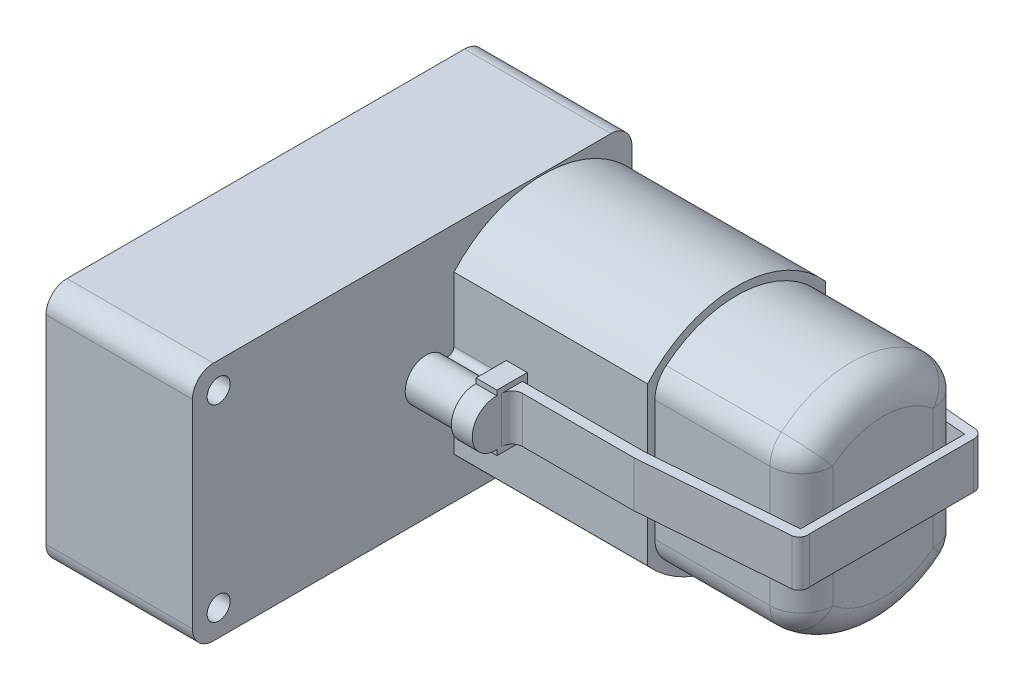
from build123d import *
from build123d.topology import SkipClean

# Parameters (mm, degrees)
SKETCH1_W                = 14
SKETCH1_H                = 42
MAIN_BODY_DEPTH          = 23
FILLET1_R                = 2
MOTOR_HOLDER_DEPTH       = 18.5
BOSS_EXTRUDE3_DEPTH      = 5
SKETCH4_R                = 1.1
NUT_HOLES_DEPTH          = 15
SKETCH5_W                = 2
SKETCH5_H                = 4
BOSS_EXTRUDE4_DEPTH      = 5
BOSS_EXTRUDE5_DEPTH      = 4
CUT_EXTRUDE2_START       = -2
CUT_EXTRUDE2_DEPTH       = 2
BOSS_EXTRUDE6_DEPTH      = 14
BOSS_EXTRUDE7_DEPTH      = 2
FILLET2_R                = 3
BOSS_EXTRUDE8_DEPTH      = 2.2
BOSS_EXTRUDE8_DEPTH_BACK = 2.2
FILLET3_R                = 1
SKETCH12_R               = 3.5
SKETCH12_R_2             = 3.070336519
BOSS_EXTRUDE9_DEPTH      = 1
SKETCH14_R               = 3
BOSS_EXTRUDE10_DEPTH     = 1
SKETCH15_R               = 1
SHAFT_DEPTH              = 7
SKETCH16_R               = 2
BOSS_EXTRUDE12_DEPTH     = 1.5


with BuildPart() as part:
    # Sketch1 → Main Body (new body)
    with BuildSketch(Plane(origin=(0, 0, 0), x_dir=(1, 0, 0), z_dir=(0, 1, 0))):
        with Locations((-14.72963025, -0.456790856)):
            Rectangle(SKETCH1_W, SKETCH1_H)
    extrude(amount=MAIN_BODY_DEPTH)

    # Fillet1
    fillet1_edges = [part.edges().sort_by_distance(p)[0] for p in [
        (-14.72963025, 23, -20.543209144),
        (-14.72963025, 0, -20.543209144),
        (-14.72963025, 0, 21.456790856),
        (-14.72963025, 23, 21.456790856),
    ]]
    fillet(fillet1_edges, radius=FILLET1_R)

    # Sketch2 → Motor Holder (add)
    with BuildSketch(Plane(origin=(-7.72963025, 0, 0), x_dir=(0, 0, -1), z_dir=(1, 0, 0))):
        with BuildLine():
            Line((3.543209144, 19.033283793), (3.543209144, 3.966716207))
            ThreePointArc((3.543209144, 3.966716207), (12.043209144, 0.142167253), (20.543209144, 3.966716207))
            Line((20.543209144, 3.966716207), (20.543209144, 19.033283793))
            ThreePointArc((20.543209144, 19.033283793), (12.043209144, 22.857832747), (3.543209144, 19.033283793))
        make_face()
    extrude(amount=MOTOR_HOLDER_DEPTH)

    # Sketch3 → Boss-Extrude3 (add)
    with BuildSketch(Plane(origin=(-7.72963025, 0, 0), x_dir=(0, 0, -1), z_dir=(1, 0, 0))):
        with BuildLine():
            Line((3.543209144, 12.866872794), (3.543209144, 10.327683852))
            ThreePointArc((3.543209144, 10.327683852), (3.130583543, 10.726570697), (2.605351044, 10.495266949))
            ThreePointArc((2.605351044, 10.495266949), (-1.12344994, 11.454900344), (2.558290761, 12.581682682))
            ThreePointArc((2.558290761, 12.581682682), (3.155784465, 12.361535772), (3.543209144, 12.866872794))
        make_face()
    extrude(amount=BOSS_EXTRUDE3_DEPTH)

    # Sketch4 → Nut Holes (cut)
    with BuildSketch(Plane(origin=(-7.72963025, 0, 0), x_dir=(0, 0, -1), z_dir=(1, 0, 0))):
        with Locations((-18.956790856, 20.5)):
            Circle(SKETCH4_R)
        with Locations((-18.956790856, 2.5)):
            Circle(SKETCH4_R)
    extrude(amount=-NUT_HOLES_DEPTH, mode=Mode.SUBTRACT)

    # Sketch5 → Boss-Extrude4 (add)
    with BuildSketch(Plane(origin=(0, 0, -20.543209144), x_dir=(-1, 0, 0), z_dir=(0, 0, -1))):
        with Locations((7.72963025, 11.5)):
            Rectangle(SKETCH5_W, SKETCH5_H)
    extrude(amount=BOSS_EXTRUDE4_DEPTH)

    # Sketch6 → Boss-Extrude5 (add)
    with BuildSketch(Plane(origin=(-6.72963025, 0, 0), x_dir=(0, 0, -1), z_dir=(1, 0, 0))):
        with BuildLine():
            ThreePointArc((21.679339079, 10.774749435), (23.912167048, 9.534327071), (25.543209144, 11.5))
            ThreePointArc((25.543209144, 11.5), (23.912167048, 13.465672929), (21.679339079, 12.225250565))
            ThreePointArc((21.679339079, 12.225250565), (21.665841795, 12.183376686), (21.649262587, 12.142624651))
            ThreePointArc((21.649262587, 12.142624651), (21.543692429, 11.456035136), (21.679339079, 10.774749435))
        make_face()
        with BuildLine():
            ThreePointArc((20.543209144, 10.774749435), (21.111274111, 11.147288257), (21.679339079, 10.774749435))
            ThreePointArc((21.679339079, 10.774749435), (21.543692429, 11.456035136), (21.649262587, 12.142624651))
            ThreePointArc((21.649262587, 12.142624651), (21.067309248, 11.796717861), (20.543209144, 12.225250565))
            Line((20.543209144, 12.225250565), (20.543209144, 10.774749435))
        make_face()
    extrude(amount=BOSS_EXTRUDE5_DEPTH)

    # Sketch7 → Cut-Extrude2 (cut)
    with BuildSketch(Plane(origin=(-6.72963025, 0, 0), x_dir=(0, 0, -1), z_dir=(1, 0, 0)).offset(CUT_EXTRUDE2_START)):
        with BuildLine():
            Line((23.543209144, 13.5), (23.543209144, 13.967200788))
            Line((23.543209144, 13.967200788), (25.760178749, 13.967200788))
            Line((25.760178749, 13.967200788), (25.760178749, 8.970470958))
            Line((25.760178749, 8.970470958), (23.543209144, 8.970470958))
            Line((23.543209144, 8.970470958), (23.543209144, 9.5))
            ThreePointArc((23.543209144, 9.5), (25.543209144, 11.5), (23.543209144, 13.5))
        make_face()
    extrude(amount=CUT_EXTRUDE2_DEPTH, mode=Mode.SUBTRACT)

    # Sketch8 → Boss-Extrude6 (add)
    with BuildSketch(Plane(origin=(10.77036975, 0, 0), x_dir=(0, 0, -1), z_dir=(1, 0, 0))):
        with BuildLine():
            Line((4.243209144, 17.35646316), (4.243209144, 5.822511997))
            ThreePointArc((4.243209144, 5.822511997), (4.526819665, 4.549237399), (5.324027945, 3.516705516))
            ThreePointArc((5.324027945, 3.516705516), (12.043209144, 1.086287771), (18.762390342, 3.516705516))
            ThreePointArc((18.762390342, 3.516705516), (19.559598622, 4.549237399), (19.843209144, 5.822511997))
            Line((19.843209144, 5.822511997), (19.843209144, 17.35646316))
            ThreePointArc((19.843209144, 17.35646316), (19.559598622, 18.629737758), (18.762390342, 19.66226964))
            ThreePointArc((18.762390342, 19.66226964), (12.043209144, 22.092687386), (5.324027945, 19.66226964))
            ThreePointArc((5.324027945, 19.66226964), (4.526819665, 18.629737758), (4.243209144, 17.35646316))
        make_face()
    extrude(amount=BOSS_EXTRUDE6_DEPTH)

    # Sketch9 → Boss-Extrude7 (add)
    with BuildSketch(Plane(origin=(-2.72963025, 0, 0), x_dir=(0, 0, -1), z_dir=(1, 0, 0))):
        with BuildLine():
            Line((20.534219475, 8.784213792), (23.432322776, 8.784213792))
            Line((23.432322776, 8.784213792), (23.432322776, 9.263820028))
            ThreePointArc((23.432322776, 9.263820028), (25.790969288, 11.48725138), (23.432322776, 13.710682731))
            Line((23.432322776, 13.710682731), (23.432322776, 14.220655847))
            Line((23.432322776, 14.220655847), (20.534219475, 14.220655847))
            Line((20.534219475, 14.220655847), (20.534219475, 8.784213792))
        make_face()
        with BuildLine():
            Line((3.543209144, 8.784213792), (0.645105842, 8.784213792))
            Line((0.645105842, 8.784213792), (0.645105842, 9.294186907))
            ThreePointArc((0.645105842, 9.294186907), (-1.71354067, 11.517618258), (0.645105842, 13.74104961))
            Line((0.645105842, 13.74104961), (0.645105842, 14.220655847))
            Line((0.645105842, 14.220655847), (3.543209144, 14.220655847))
            Line((3.543209144, 14.220655847), (3.543209144, 8.784213792))
        make_face()
    extrude(amount=BOSS_EXTRUDE7_DEPTH)

    # Fillet2
    fillet2_edges = [part.edges().sort_by_distance(p)[0] for p in [
        (24.77036975, 18.629737758, -4.526819665),
        (24.77036975, 11.589487578, -4.243209144),
        (24.77036975, 4.549237399, -4.526819665),
        (24.77036975, 1.086287771, -12.043209144),
        (24.77036975, 4.549237399, -19.559598622),
        (24.77036975, 11.589487578, -19.843209144),
        (24.77036975, 18.629737758, -19.559598622),
        (24.77036975, 22.092687386, -12.043209144),
    ]]
    fillet(fillet2_edges, radius=FILLET2_R)

    # Sketch10 → Boss-Extrude8 (add, two sides: drawn at the far end of the back side and taken through both)
    with BuildSketch(Plane(origin=(0, 11.5176, 0), x_dir=(1, 0, 0), z_dir=(0, 1, 0)).offset(-BOSS_EXTRUDE8_DEPTH_BACK)):
        with BuildLine():
            Line((-0.72963025, 21.98776596), (10.910253109, 21.98776596))
            Line((10.910253109, 21.98776596), (24.77036975, 20.809448862))
            ThreePointArc((24.77036975, 20.809448862), (25.391050954, 20.50205534), (25.604727399, 19.843209144))
            Line((25.604727399, 19.843209144), (25.604727399, 4.166099851))
            ThreePointArc((25.604727399, 4.166099851), (25.476560723, 3.537376336), (24.938530753, 3.187742664))
            Line((24.938530753, 3.187742664), (10.910253109, 2.094157493))
            Line((10.910253109, 2.094157493), (-0.72963025, 2.094157493))
            Line((-0.72963025, 2.094157493), (-0.72963025, 3.0856238))
            Line((-0.72963025, 3.0856238), (10.910253109, 3.0856238))
            Line((10.910253109, 3.0856238), (24.77036975, 4.166099851))
            Line((24.77036975, 4.166099851), (24.77036975, 19.843209144))
            Line((24.77036975, 19.843209144), (10.910253109, 21.021526241))
            Line((10.910253109, 21.021526241), (-0.72963025, 21.021526241))
            Line((-0.72963025, 21.021526241), (-0.72963025, 21.98776596))
        make_face()
    extrude(amount=BOSS_EXTRUDE8_DEPTH + BOSS_EXTRUDE8_DEPTH_BACK)

    # Fillet3
    fillet3_edges = [part.edges().sort_by_distance(p)[0] for p in [
        (-0.72963025, 11.5176, -21.98776596),
        (-0.72963025, 11.5176, -2.094157493),
    ]]
    fillet(fillet3_edges, radius=FILLET3_R)

    # Sketch12 → Boss-Extrude9 (add)
    with BuildSketch(Plane.ZY.offset(21.72963025)):
        with Locations(Location((10.456790856, 11.5, 0), (0, 0, 180))):
            Circle(SKETCH12_R)
        with Locations((10.456790856, 11.5)):
            Circle(SKETCH12_R_2, mode=Mode.SUBTRACT)
    extrude(amount=BOSS_EXTRUDE9_DEPTH)

    # Sketch14 → Boss-Extrude10 (add)
    with BuildSketch(Plane.ZY.offset(21.72963025)):
        with Locations(Location((10.456790856, 11.5, 0), (0, 0, 180))):
            Circle(SKETCH14_R)
    extrude(amount=BOSS_EXTRUDE10_DEPTH)

    # Sketch15 → Shaft (add)
    with SkipClean():  # the faces are left unmerged after this step: merging them gives an invalid solid
        with BuildSketch(Plane.ZY.offset(22.72963025)):
            with BuildLine():
                Line((8.848293419, 8.967661951), (8.848293419, 14.032338049))
                ThreePointArc((8.848293419, 14.032338049), (10.456790856, 14.5), (12.065288294, 14.032338049))
                Line((12.065288294, 14.032338049), (12.065288294, 8.967661951))
                ThreePointArc((12.065288294, 8.967661951), (10.456790856, 8.5), (8.848293419, 8.967661951))
            make_face()
            with Locations((10.456790856, 11.5)):
                Circle(SKETCH15_R, mode=Mode.SUBTRACT)
        extrude(amount=SHAFT_DEPTH)

    # Sketch16 → Boss-Extrude12 (add)
    with SkipClean():  # the faces are left unmerged after this step: merging them gives an invalid solid
        with BuildSketch(Plane.ZY.offset(21.72963025)):
            with Locations(Location((-0.543209144, 11.5, 0), (0, 0, 180))):
                Circle(SKETCH16_R)
        extrude(amount=BOSS_EXTRUDE12_DEPTH)


solid = part.part
